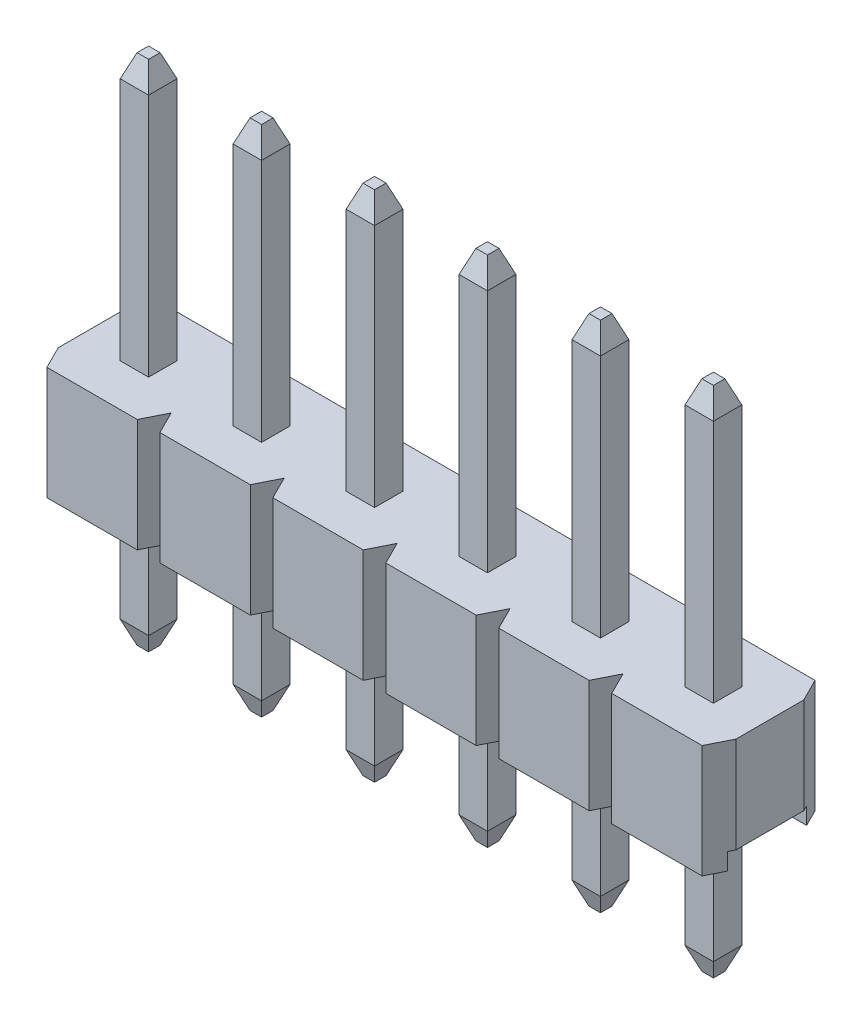
from build123d import *
from OCP.BRepFilletAPI import BRepFilletAPI_MakeChamfer

# Parameters (mm, degrees)
SKETCH1_W                     = 2.54
SKETCH1_H                     = 2.54
MAIN_BODY_DEPTH               = 2.54
SKETCH3_W                     = 1.778
SKETCH3_H                     = 0.381
CUT_EXTRUDE1_DEPTH            = 5.399409051
CUT_EXTRUDE2_DEPTH            = 5.399409051
BODY_PATTERN_COUNT            = 6
BODY_PATTERN_PITCH            = 2.54
PIN_START                     = -5.54
SKETCH2_W                     = 0.64
SKETCH2_H                     = 0.64
PIN_DEPTH                     = 11.54
CHAMFER1_SIZE                 = 0.508
CHAMFER1_SIZE2                = 0.1905
CHAMFER2_SIZE                 = 0.1905
CHAMFER2_SIZE2                = 0.508
PIN_PATTERN_COUNT             = 6
PIN_PATTERN_PITCH             = 2.54
CHAMFER1_OF_PIN_PATTERN_SIZE  = 0.508
CHAMFER1_OF_PIN_PATTERN_SIZE2 = 0.1905
CHAMFER2_OF_PIN_PATTERN_SIZE2 = 0.1905
CHAMFER2_OF_PIN_PATTERN_SIZE  = 0.508


with BuildPart() as part:
    # Sketch1 → Main Body (new body)
    with BuildSketch(Plane(origin=(0, 0, 0), x_dir=(1, 0, 0), z_dir=(0, 1, 0))):
        with Locations((1.27, 1.27)):
            Rectangle(SKETCH1_W, SKETCH1_H)
    main_body = extrude(amount=MAIN_BODY_DEPTH)

    # Sketch3 → Cut-Extrude1 (cut, through all)
    with BuildSketch(Plane.ZY):
        with Locations((-1.27, 0.1905)):
            Rectangle(SKETCH3_W, SKETCH3_H)
    cut_extrude1 = extrude(amount=-CUT_EXTRUDE1_DEPTH, mode=Mode.SUBTRACT)

    # Sketch4 → Cut-Extrude2 (cut, through all)
    with BuildSketch(Plane(origin=(0, 2.54, 0), x_dir=(1, 0, 0), z_dir=(0, 1, 0))):
        Polygon((0.254, 2.54), (0, 2.54), (0, 2.032), align=None)
        Polygon((2.54, 2.54), (2.286, 2.54), (2.54, 2.032), align=None)
        Polygon((0.254, 0), (0, 0.508), (0, 0), align=None)
        Polygon((2.54, 0), (2.286, 0), (2.54, 0.508), align=None)
    cut_extrude2 = extrude(amount=-CUT_EXTRUDE2_DEPTH, mode=Mode.SUBTRACT)

    # Body Pattern: Main Body, Cut-Extrude1, Cut-Extrude2 ×6
    with Locations(*[(-i * BODY_PATTERN_PITCH, 0, 0) for i in range(1, BODY_PATTERN_COUNT)]):
        add(main_body)
        add(cut_extrude1, mode=Mode.SUBTRACT)
        add(cut_extrude2, mode=Mode.SUBTRACT)

    # Sketch2 → Pin (add)
    with BuildSketch(Plane(origin=(0, 2.54, 0), x_dir=(1, 0, 0), z_dir=(0, 1, 0)).offset(PIN_START)):
        with Locations((1.27, 1.27)):
            Rectangle(SKETCH2_W, SKETCH2_H)
    pin = extrude(amount=PIN_DEPTH)

    # Chamfer1: one chamfer whose edges measure the first distance from different faces: ONE call of the kernel's chamfer builder (chamfer() names one face for all edges)
    chamfer1_edges_1 = [part.edges().sort_by_distance(p)[0] for p in [
        (0.95, 8.54, -1.27),
    ]]
    chamfer1_side_1 = [part.faces().sort_by_distance(p)[0] for p in [
        (0.95, 5.54, -1.27),
    ]]
    chamfer1_edges_2 = [part.edges().sort_by_distance(p)[0] for p in [
        (1.27, 8.54, -0.95),
    ]]
    chamfer1_side_2 = [part.faces().sort_by_distance(p)[0] for p in [
        (1.27, 5.54, -0.95),
    ]]
    chamfer1_edges_3 = [part.edges().sort_by_distance(p)[0] for p in [
        (1.59, 8.54, -1.27),
    ]]
    chamfer1_side_3 = [part.faces().sort_by_distance(p)[0] for p in [
        (1.59, 5.54, -1.27),
    ]]
    chamfer1_edges_4 = [part.edges().sort_by_distance(p)[0] for p in [
        (1.27, 8.54, -1.59),
    ]]
    chamfer1_side_4 = [part.faces().sort_by_distance(p)[0] for p in [
        (1.27, 5.54, -1.59),
    ]]
    chamfer1 = BRepFilletAPI_MakeChamfer(part.part.solid().wrapped)
    for e in chamfer1_edges_1:
        chamfer1.Add(CHAMFER1_SIZE, CHAMFER1_SIZE2, e.wrapped, chamfer1_side_1[0].wrapped)  # the first distance lies on this face
    for e in chamfer1_edges_2:
        chamfer1.Add(CHAMFER1_SIZE, CHAMFER1_SIZE2, e.wrapped, chamfer1_side_2[0].wrapped)  # the first distance lies on this face
    for e in chamfer1_edges_3:
        chamfer1.Add(CHAMFER1_SIZE, CHAMFER1_SIZE2, e.wrapped, chamfer1_side_3[0].wrapped)  # the first distance lies on this face
    for e in chamfer1_edges_4:
        chamfer1.Add(CHAMFER1_SIZE, CHAMFER1_SIZE2, e.wrapped, chamfer1_side_4[0].wrapped)  # the first distance lies on this face
    add(Compound.cast(chamfer1.Shape()), mode=Mode.REPLACE)

    # Chamfer2
    chamfer2_edges = [part.edges().sort_by_distance(p)[0] for p in [
        (1.27, -3, -0.95),
        (1.59, -3, -1.27),
        (1.27, -3, -1.59),
        (0.95, -3, -1.27),
    ]]
    chamfer2_side = [part.faces().sort_by_distance(p)[0] for p in [
        (1.27, -3, -1.27),
    ]]
    chamfer(chamfer2_edges, length=CHAMFER2_SIZE, length2=CHAMFER2_SIZE2, reference=chamfer2_side[0])

    # Pin Pattern: Pin ×6
    with Locations(*[(-i * PIN_PATTERN_PITCH, 0, 0) for i in range(1, PIN_PATTERN_COUNT)]):
        add(pin)

    # Chamfer1 of Pin Pattern: one chamfer whose edges measure the first distance from different faces: ONE call of the kernel's chamfer builder (chamfer() names one face for all edges)
    chamfer1_of_pin_pattern_edges_1 = [part.edges().sort_by_distance(p)[0] for p in [
        (-1.59, 8.54, -1.27),
    ]]
    chamfer1_of_pin_pattern_side_1 = [part.faces().sort_by_distance(p)[0] for p in [
        (-1.59, 5.54, -1.27),
    ]]
    chamfer1_of_pin_pattern_edges_2 = [part.edges().sort_by_distance(p)[0] for p in [
        (-1.27, 8.54, -0.95),
    ]]
    chamfer1_of_pin_pattern_side_2 = [part.faces().sort_by_distance(p)[0] for p in [
        (-1.27, 5.54, -0.95),
    ]]
    chamfer1_of_pin_pattern_edges_3 = [part.edges().sort_by_distance(p)[0] for p in [
        (-0.95, 8.54, -1.27),
    ]]
    chamfer1_of_pin_pattern_side_3 = [part.faces().sort_by_distance(p)[0] for p in [
        (-0.95, 5.54, -1.27),
    ]]
    chamfer1_of_pin_pattern_edges_4 = [part.edges().sort_by_distance(p)[0] for p in [
        (-1.27, 8.54, -1.59),
    ]]
    chamfer1_of_pin_pattern_side_4 = [part.faces().sort_by_distance(p)[0] for p in [
        (-1.27, 5.54, -1.59),
    ]]
    chamfer1_of_pin_pattern_edges_5 = [part.edges().sort_by_distance(p)[0] for p in [
        (-4.13, 8.54, -1.27),
    ]]
    chamfer1_of_pin_pattern_side_5 = [part.faces().sort_by_distance(p)[0] for p in [
        (-4.13, 5.54, -1.27),
    ]]
    chamfer1_of_pin_pattern_edges_6 = [part.edges().sort_by_distance(p)[0] for p in [
        (-3.81, 8.54, -0.95),
    ]]
    chamfer1_of_pin_pattern_side_6 = [part.faces().sort_by_distance(p)[0] for p in [
        (-3.81, 5.54, -0.95),
    ]]
    chamfer1_of_pin_pattern_edges_7 = [part.edges().sort_by_distance(p)[0] for p in [
        (-3.49, 8.54, -1.27),
    ]]
    chamfer1_of_pin_pattern_side_7 = [part.faces().sort_by_distance(p)[0] for p in [
        (-3.49, 5.54, -1.27),
    ]]
    chamfer1_of_pin_pattern_edges_8 = [part.edges().sort_by_distance(p)[0] for p in [
        (-3.81, 8.54, -1.59),
    ]]
    chamfer1_of_pin_pattern_side_8 = [part.faces().sort_by_distance(p)[0] for p in [
        (-3.81, 5.54, -1.59),
    ]]
    chamfer1_of_pin_pattern_edges_9 = [part.edges().sort_by_distance(p)[0] for p in [
        (-6.67, 8.54, -1.27),
    ]]
    chamfer1_of_pin_pattern_side_9 = [part.faces().sort_by_distance(p)[0] for p in [
        (-6.67, 5.54, -1.27),
    ]]
    chamfer1_of_pin_pattern_edges_10 = [part.edges().sort_by_distance(p)[0] for p in [
        (-6.35, 8.54, -0.95),
    ]]
    chamfer1_of_pin_pattern_side_10 = [part.faces().sort_by_distance(p)[0] for p in [
        (-6.35, 5.54, -0.95),
    ]]
    chamfer1_of_pin_pattern_edges_11 = [part.edges().sort_by_distance(p)[0] for p in [
        (-6.03, 8.54, -1.27),
    ]]
    chamfer1_of_pin_pattern_side_11 = [part.faces().sort_by_distance(p)[0] for p in [
        (-6.03, 5.54, -1.27),
    ]]
    chamfer1_of_pin_pattern_edges_12 = [part.edges().sort_by_distance(p)[0] for p in [
        (-6.35, 8.54, -1.59),
    ]]
    chamfer1_of_pin_pattern_side_12 = [part.faces().sort_by_distance(p)[0] for p in [
        (-6.35, 5.54, -1.59),
    ]]
    chamfer1_of_pin_pattern_edges_13 = [part.edges().sort_by_distance(p)[0] for p in [
        (-9.21, 8.54, -1.27),
    ]]
    chamfer1_of_pin_pattern_side_13 = [part.faces().sort_by_distance(p)[0] for p in [
        (-9.21, 5.54, -1.27),
    ]]
    chamfer1_of_pin_pattern_edges_14 = [part.edges().sort_by_distance(p)[0] for p in [
        (-8.89, 8.54, -0.95),
    ]]
    chamfer1_of_pin_pattern_side_14 = [part.faces().sort_by_distance(p)[0] for p in [
        (-8.89, 5.54, -0.95),
    ]]
    chamfer1_of_pin_pattern_edges_15 = [part.edges().sort_by_distance(p)[0] for p in [
        (-8.57, 8.54, -1.27),
    ]]
    chamfer1_of_pin_pattern_side_15 = [part.faces().sort_by_distance(p)[0] for p in [
        (-8.57, 5.54, -1.27),
    ]]
    chamfer1_of_pin_pattern_edges_16 = [part.edges().sort_by_distance(p)[0] for p in [
        (-8.89, 8.54, -1.59),
    ]]
    chamfer1_of_pin_pattern_side_16 = [part.faces().sort_by_distance(p)[0] for p in [
        (-8.89, 5.54, -1.59),
    ]]
    chamfer1_of_pin_pattern_edges_17 = [part.edges().sort_by_distance(p)[0] for p in [
        (-11.75, 8.54, -1.27),
    ]]
    chamfer1_of_pin_pattern_side_17 = [part.faces().sort_by_distance(p)[0] for p in [
        (-11.75, 5.54, -1.27),
    ]]
    chamfer1_of_pin_pattern_edges_18 = [part.edges().sort_by_distance(p)[0] for p in [
        (-11.43, 8.54, -0.95),
    ]]
    chamfer1_of_pin_pattern_side_18 = [part.faces().sort_by_distance(p)[0] for p in [
        (-11.43, 5.54, -0.95),
    ]]
    chamfer1_of_pin_pattern_edges_19 = [part.edges().sort_by_distance(p)[0] for p in [
        (-11.11, 8.54, -1.27),
    ]]
    chamfer1_of_pin_pattern_side_19 = [part.faces().sort_by_distance(p)[0] for p in [
        (-11.11, 5.54, -1.27),
    ]]
    chamfer1_of_pin_pattern_edges_20 = [part.edges().sort_by_distance(p)[0] for p in [
        (-11.43, 8.54, -1.59),
    ]]
    chamfer1_of_pin_pattern_side_20 = [part.faces().sort_by_distance(p)[0] for p in [
        (-11.43, 5.54, -1.59),
    ]]
    chamfer1_of_pin_pattern = BRepFilletAPI_MakeChamfer(part.part.solid().wrapped)
    for e in chamfer1_of_pin_pattern_edges_1:
        chamfer1_of_pin_pattern.Add(CHAMFER1_OF_PIN_PATTERN_SIZE, CHAMFER1_OF_PIN_PATTERN_SIZE2, e.wrapped, chamfer1_of_pin_pattern_side_1[0].wrapped)  # the first distance lies on this face
    for e in chamfer1_of_pin_pattern_edges_2:
        chamfer1_of_pin_pattern.Add(CHAMFER1_OF_PIN_PATTERN_SIZE, CHAMFER1_OF_PIN_PATTERN_SIZE2, e.wrapped, chamfer1_of_pin_pattern_side_2[0].wrapped)  # the first distance lies on this face
    for e in chamfer1_of_pin_pattern_edges_3:
        chamfer1_of_pin_pattern.Add(CHAMFER1_OF_PIN_PATTERN_SIZE, CHAMFER1_OF_PIN_PATTERN_SIZE2, e.wrapped, chamfer1_of_pin_pattern_side_3[0].wrapped)  # the first distance lies on this face
    for e in chamfer1_of_pin_pattern_edges_4:
        chamfer1_of_pin_pattern.Add(CHAMFER1_OF_PIN_PATTERN_SIZE, CHAMFER1_OF_PIN_PATTERN_SIZE2, e.wrapped, chamfer1_of_pin_pattern_side_4[0].wrapped)  # the first distance lies on this face
    for e in chamfer1_of_pin_pattern_edges_5:
        chamfer1_of_pin_pattern.Add(CHAMFER1_OF_PIN_PATTERN_SIZE, CHAMFER1_OF_PIN_PATTERN_SIZE2, e.wrapped, chamfer1_of_pin_pattern_side_5[0].wrapped)  # the first distance lies on this face
    for e in chamfer1_of_pin_pattern_edges_6:
        chamfer1_of_pin_pattern.Add(CHAMFER1_OF_PIN_PATTERN_SIZE, CHAMFER1_OF_PIN_PATTERN_SIZE2, e.wrapped, chamfer1_of_pin_pattern_side_6[0].wrapped)  # the first distance lies on this face
    for e in chamfer1_of_pin_pattern_edges_7:
        chamfer1_of_pin_pattern.Add(CHAMFER1_OF_PIN_PATTERN_SIZE, CHAMFER1_OF_PIN_PATTERN_SIZE2, e.wrapped, chamfer1_of_pin_pattern_side_7[0].wrapped)  # the first distance lies on this face
    for e in chamfer1_of_pin_pattern_edges_8:
        chamfer1_of_pin_pattern.Add(CHAMFER1_OF_PIN_PATTERN_SIZE, CHAMFER1_OF_PIN_PATTERN_SIZE2, e.wrapped, chamfer1_of_pin_pattern_side_8[0].wrapped)  # the first distance lies on this face
    for e in chamfer1_of_pin_pattern_edges_9:
        chamfer1_of_pin_pattern.Add(CHAMFER1_OF_PIN_PATTERN_SIZE, CHAMFER1_OF_PIN_PATTERN_SIZE2, e.wrapped, chamfer1_of_pin_pattern_side_9[0].wrapped)  # the first distance lies on this face
    for e in chamfer1_of_pin_pattern_edges_10:
        chamfer1_of_pin_pattern.Add(CHAMFER1_OF_PIN_PATTERN_SIZE, CHAMFER1_OF_PIN_PATTERN_SIZE2, e.wrapped, chamfer1_of_pin_pattern_side_10[0].wrapped)  # the first distance lies on this face
    for e in chamfer1_of_pin_pattern_edges_11:
        chamfer1_of_pin_pattern.Add(CHAMFER1_OF_PIN_PATTERN_SIZE, CHAMFER1_OF_PIN_PATTERN_SIZE2, e.wrapped, chamfer1_of_pin_pattern_side_11[0].wrapped)  # the first distance lies on this face
    for e in chamfer1_of_pin_pattern_edges_12:
        chamfer1_of_pin_pattern.Add(CHAMFER1_OF_PIN_PATTERN_SIZE, CHAMFER1_OF_PIN_PATTERN_SIZE2, e.wrapped, chamfer1_of_pin_pattern_side_12[0].wrapped)  # the first distance lies on this face
    for e in chamfer1_of_pin_pattern_edges_13:
        chamfer1_of_pin_pattern.Add(CHAMFER1_OF_PIN_PATTERN_SIZE, CHAMFER1_OF_PIN_PATTERN_SIZE2, e.wrapped, chamfer1_of_pin_pattern_side_13[0].wrapped)  # the first distance lies on this face
    for e in chamfer1_of_pin_pattern_edges_14:
        chamfer1_of_pin_pattern.Add(CHAMFER1_OF_PIN_PATTERN_SIZE, CHAMFER1_OF_PIN_PATTERN_SIZE2, e.wrapped, chamfer1_of_pin_pattern_side_14[0].wrapped)  # the first distance lies on this face
    for e in chamfer1_of_pin_pattern_edges_15:
        chamfer1_of_pin_pattern.Add(CHAMFER1_OF_PIN_PATTERN_SIZE, CHAMFER1_OF_PIN_PATTERN_SIZE2, e.wrapped, chamfer1_of_pin_pattern_side_15[0].wrapped)  # the first distance lies on this face
    for e in chamfer1_of_pin_pattern_edges_16:
        chamfer1_of_pin_pattern.Add(CHAMFER1_OF_PIN_PATTERN_SIZE, CHAMFER1_OF_PIN_PATTERN_SIZE2, e.wrapped, chamfer1_of_pin_pattern_side_16[0].wrapped)  # the first distance lies on this face
    for e in chamfer1_of_pin_pattern_edges_17:
        chamfer1_of_pin_pattern.Add(CHAMFER1_OF_PIN_PATTERN_SIZE, CHAMFER1_OF_PIN_PATTERN_SIZE2, e.wrapped, chamfer1_of_pin_pattern_side_17[0].wrapped)  # the first distance lies on this face
    for e in chamfer1_of_pin_pattern_edges_18:
        chamfer1_of_pin_pattern.Add(CHAMFER1_OF_PIN_PATTERN_SIZE, CHAMFER1_OF_PIN_PATTERN_SIZE2, e.wrapped, chamfer1_of_pin_pattern_side_18[0].wrapped)  # the first distance lies on this face
    for e in chamfer1_of_pin_pattern_edges_19:
        chamfer1_of_pin_pattern.Add(CHAMFER1_OF_PIN_PATTERN_SIZE, CHAMFER1_OF_PIN_PATTERN_SIZE2, e.wrapped, chamfer1_of_pin_pattern_side_19[0].wrapped)  # the first distance lies on this face
    for e in chamfer1_of_pin_pattern_edges_20:
        chamfer1_of_pin_pattern.Add(CHAMFER1_OF_PIN_PATTERN_SIZE, CHAMFER1_OF_PIN_PATTERN_SIZE2, e.wrapped, chamfer1_of_pin_pattern_side_20[0].wrapped)  # the first distance lies on this face
    add(Compound.cast(chamfer1_of_pin_pattern.Shape()), mode=Mode.REPLACE)

    # Chamfer2 of Pin Pattern
    chamfer2_of_pin_pattern_edges = [part.edges().sort_by_distance(p)[0] for p in [
        (-1.27, -3, -0.95),
        (-0.95, -3, -1.27),
        (-1.27, -3, -1.59),
        (-1.59, -3, -1.27),
        (-3.81, -3, -0.95),
        (-3.49, -3, -1.27),
        (-3.81, -3, -1.59),
        (-4.13, -3, -1.27),
        (-6.35, -3, -0.95),
        (-6.03, -3, -1.27),
        (-6.35, -3, -1.59),
        (-6.67, -3, -1.27),
        (-8.89, -3, -0.95),
        (-8.57, -3, -1.27),
        (-8.89, -3, -1.59),
        (-9.21, -3, -1.27),
        (-11.43, -3, -0.95),
        (-11.11, -3, -1.27),
        (-11.43, -3, -1.59),
        (-11.75, -3, -1.27),
    ]]
    chamfer(chamfer2_of_pin_pattern_edges, length=CHAMFER2_OF_PIN_PATTERN_SIZE, length2=CHAMFER2_OF_PIN_PATTERN_SIZE2)


solid = part.part
